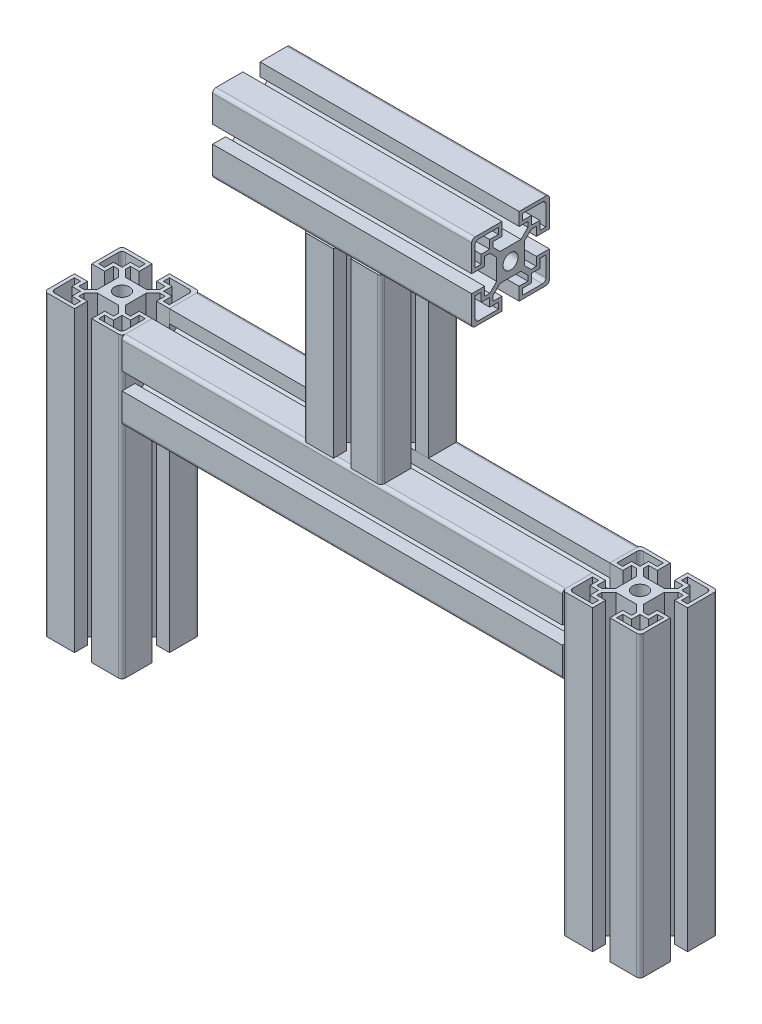
from build123d import *

# Parameters (mm, degrees)
PERFIL_ALUMINIO_45_X_45_1_DEPTH      = 150
PERFIL_ALUMINIO_45_X_45_1_DEPTH_BACK = 22.5
SKETCH16_R                           = 4.356346288
SKETCH16_ON_SEGMENT_2_R              = 4.356346288
PERFIL_ALUMINIO_45_X_45_1_2_DEPTH    = 172.5
SKETCH16_ON_SEGMENT_3_R              = 4.356346288
PERFIL_ALUMINIO_45_X_45_1_3_DEPTH    = 152
SKETCH16_ON_SEGMENT_4_R              = 4.356346288
PERFIL_ALUMINIO_45_X_45_1_4_DEPTH    = 302
SKETCH16_ON_SEGMENT_5_R              = 4.356346288
PERFIL_ALUMINIO_45_X_45_1_5_DEPTH    = 150


with BuildPart() as part:
    # Sketch16 → Perfil aluminio 45 X 45(1) (new, two sides: drawn at the far end of the back side and taken through both)
    with BuildSketch(Plane(origin=(157.534246575, 68.721461187, 0), x_dir=(1, 0, 0), z_dir=(0, -1, 0)).offset(-PERFIL_ALUMINIO_45_X_45_1_DEPTH_BACK)):
        with BuildLine():
            Line((-20.5, 22.5), (-5, 22.5))
            Line((-5, 22.5), (-5, 14.982887044))
            Line((-5, 14.982887044), (-10.05, 14.982887044))
            Line((-10.05, 14.982887044), (-10.05, 11.990221168))
            Line((-10.05, 11.990221168), (-6.059778832, 8))
            Line((-6.059778832, 8), (6.059778832, 8))
            Line((6.059778832, 8), (10.05, 11.990221168))
            Line((10.05, 11.990221168), (10.05, 14.982887044))
            Line((10.05, 14.982887044), (5, 14.982887044))
            Line((5, 14.982887044), (5, 22.5))
            Line((5, 22.5), (20.5, 22.5))
            ThreePointArc((20.5, 22.5), (21.914213562, 21.914213562), (22.5, 20.5))
            Line((22.5, 20.5), (22.5, 5))
            Line((22.5, 5), (14.982887044, 5))
            Line((14.982887044, 5), (14.982887044, 10.05))
            Line((14.982887044, 10.05), (11.990221168, 10.05))
            Line((11.990221168, 10.05), (8, 6.059778832))
            Line((8, 6.059778832), (8, -6.059778832))
            Line((8, -6.059778832), (11.990221168, -10.05))
            Line((11.990221168, -10.05), (14.982887044, -10.05))
            Line((14.982887044, -10.05), (14.982887044, -5))
            Line((14.982887044, -5), (22.5, -5))
            Line((22.5, -5), (22.5, -20.5))
            ThreePointArc((22.5, -20.5), (21.914213562, -21.914213562), (20.5, -22.5))
            Line((20.5, -22.5), (5, -22.5))
            Line((5, -22.5), (5, -14.982887044))
            Line((5, -14.982887044), (10.05, -14.982887044))
            Line((10.05, -14.982887044), (10.05, -11.990221168))
            Line((10.05, -11.990221168), (6.059778832, -8))
            Line((6.059778832, -8), (-6.059778832, -8))
            Line((-6.059778832, -8), (-10.05, -11.990221168))
            Line((-10.05, -11.990221168), (-10.05, -14.982887044))
            Line((-10.05, -14.982887044), (-5, -14.982887044))
            Line((-5, -14.982887044), (-5, -22.5))
            Line((-5, -22.5), (-20.5, -22.5))
            ThreePointArc((-20.5, -22.5), (-21.914213562, -21.914213562), (-22.5, -20.5))
            Line((-22.5, -20.5), (-22.5, -5))
            Line((-22.5, -5), (-14.982887044, -5))
            Line((-14.982887044, -5), (-14.982887044, -10.05))
            Line((-14.982887044, -10.05), (-11.990221168, -10.05))
            Line((-11.990221168, -10.05), (-8, -6.059778832))
            Line((-8, -6.059778832), (-8, 6.059778832))
            Line((-8, 6.059778832), (-11.990221168, 10.05))
            Line((-11.990221168, 10.05), (-14.982887044, 10.05))
            Line((-14.982887044, 10.05), (-14.982887044, 5))
            Line((-14.982887044, 5), (-22.5, 5))
            Line((-22.5, 5), (-22.5, 20.5))
            ThreePointArc((-22.5, 20.5), (-21.914213562, 21.914213562), (-20.5, 22.5))
        make_face()
        Circle(SKETCH16_R, mode=Mode.SUBTRACT)
        with BuildLine():
            Line((12.05, 16.982887044), (12.05, 12.05))
            Line((12.05, 12.05), (16.982887044, 12.05))
            Line((16.982887044, 12.05), (16.982887044, 7))
            Line((16.982887044, 7), (20.5, 7))
            Line((20.5, 7), (20.5, 18.5))
            ThreePointArc((20.5, 18.5), (19.914213562, 19.914213562), (18.5, 20.5))
            Line((18.5, 20.5), (7, 20.5))
            Line((7, 20.5), (7, 16.982887044))
            Line((7, 16.982887044), (12.05, 16.982887044))
        make_face(mode=Mode.SUBTRACT)
        with BuildLine():
            Line((-20.5, 18.5), (-20.5, 7))
            Line((-20.5, 7), (-16.982887044, 7))
            Line((-16.982887044, 7), (-16.982887044, 12.05))
            Line((-16.982887044, 12.05), (-12.05, 12.05))
            Line((-12.05, 12.05), (-12.05, 16.982887044))
            Line((-12.05, 16.982887044), (-7, 16.982887044))
            Line((-7, 16.982887044), (-7, 20.5))
            Line((-7, 20.5), (-18.5, 20.5))
            ThreePointArc((-18.5, 20.5), (-19.914213562, 19.914213562), (-20.5, 18.5))
        make_face(mode=Mode.SUBTRACT)
        with BuildLine():
            Line((12.05, -16.982887044), (12.05, -12.05))
            Line((12.05, -12.05), (16.982887044, -12.05))
            Line((16.982887044, -12.05), (16.982887044, -7))
            Line((16.982887044, -7), (20.5, -7))
            Line((20.5, -7), (20.5, -18.5))
            ThreePointArc((20.5, -18.5), (19.914213562, -19.914213562), (18.5, -20.5))
            Line((18.5, -20.5), (7, -20.5))
            Line((7, -20.5), (7, -16.982887044))
            Line((7, -16.982887044), (12.05, -16.982887044))
        make_face(mode=Mode.SUBTRACT)
        with BuildLine():
            Line((-20.5, -18.5), (-20.5, -7))
            Line((-20.5, -7), (-16.982887044, -7))
            Line((-16.982887044, -7), (-16.982887044, -12.05))
            Line((-16.982887044, -12.05), (-12.05, -12.05))
            Line((-12.05, -12.05), (-12.05, -16.982887044))
            Line((-12.05, -16.982887044), (-7, -16.982887044))
            Line((-7, -16.982887044), (-7, -20.5))
            Line((-7, -20.5), (-18.5, -20.5))
            ThreePointArc((-18.5, -20.5), (-19.914213562, -19.914213562), (-20.5, -18.5))
        make_face(mode=Mode.SUBTRACT)
    extrude(amount=PERFIL_ALUMINIO_45_X_45_1_DEPTH + PERFIL_ALUMINIO_45_X_45_1_DEPTH_BACK)


with BuildPart() as body_2:
    # Sketch16 on segment 2 (carried to segment 2) → Perfil aluminio 45 X 45_1 2 (new body)
    with BuildSketch(Plane(origin=(-142.465753425, 91.221461187, 0), x_dir=(1, 0, 0), z_dir=(0, -1, 0))):
        with BuildLine():
            Line((-20.5, 22.5), (-5, 22.5))
            Line((-5, 22.5), (-5, 14.982887044))
            Line((-5, 14.982887044), (-10.05, 14.982887044))
            Line((-10.05, 14.982887044), (-10.05, 11.990221168))
            Line((-10.05, 11.990221168), (-6.059778832, 8))
            Line((-6.059778832, 8), (6.059778832, 8))
            Line((6.059778832, 8), (10.05, 11.990221168))
            Line((10.05, 11.990221168), (10.05, 14.982887044))
            Line((10.05, 14.982887044), (5, 14.982887044))
            Line((5, 14.982887044), (5, 22.5))
            Line((5, 22.5), (20.5, 22.5))
            ThreePointArc((20.5, 22.5), (21.914213562, 21.914213562), (22.5, 20.5))
            Line((22.5, 20.5), (22.5, 5))
            Line((22.5, 5), (14.982887044, 5))
            Line((14.982887044, 5), (14.982887044, 10.05))
            Line((14.982887044, 10.05), (11.990221168, 10.05))
            Line((11.990221168, 10.05), (8, 6.059778832))
            Line((8, 6.059778832), (8, -6.059778832))
            Line((8, -6.059778832), (11.990221168, -10.05))
            Line((11.990221168, -10.05), (14.982887044, -10.05))
            Line((14.982887044, -10.05), (14.982887044, -5))
            Line((14.982887044, -5), (22.5, -5))
            Line((22.5, -5), (22.5, -20.5))
            ThreePointArc((22.5, -20.5), (21.914213562, -21.914213562), (20.5, -22.5))
            Line((20.5, -22.5), (5, -22.5))
            Line((5, -22.5), (5, -14.982887044))
            Line((5, -14.982887044), (10.05, -14.982887044))
            Line((10.05, -14.982887044), (10.05, -11.990221168))
            Line((10.05, -11.990221168), (6.059778832, -8))
            Line((6.059778832, -8), (-6.059778832, -8))
            Line((-6.059778832, -8), (-10.05, -11.990221168))
            Line((-10.05, -11.990221168), (-10.05, -14.982887044))
            Line((-10.05, -14.982887044), (-5, -14.982887044))
            Line((-5, -14.982887044), (-5, -22.5))
            Line((-5, -22.5), (-20.5, -22.5))
            ThreePointArc((-20.5, -22.5), (-21.914213562, -21.914213562), (-22.5, -20.5))
            Line((-22.5, -20.5), (-22.5, -5))
            Line((-22.5, -5), (-14.982887044, -5))
            Line((-14.982887044, -5), (-14.982887044, -10.05))
            Line((-14.982887044, -10.05), (-11.990221168, -10.05))
            Line((-11.990221168, -10.05), (-8, -6.059778832))
            Line((-8, -6.059778832), (-8, 6.059778832))
            Line((-8, 6.059778832), (-11.990221168, 10.05))
            Line((-11.990221168, 10.05), (-14.982887044, 10.05))
            Line((-14.982887044, 10.05), (-14.982887044, 5))
            Line((-14.982887044, 5), (-22.5, 5))
            Line((-22.5, 5), (-22.5, 20.5))
            ThreePointArc((-22.5, 20.5), (-21.914213562, 21.914213562), (-20.5, 22.5))
        make_face()
        Circle(SKETCH16_ON_SEGMENT_2_R, mode=Mode.SUBTRACT)
        with BuildLine():
            Line((12.05, 16.982887044), (12.05, 12.05))
            Line((12.05, 12.05), (16.982887044, 12.05))
            Line((16.982887044, 12.05), (16.982887044, 7))
            Line((16.982887044, 7), (20.5, 7))
            Line((20.5, 7), (20.5, 18.5))
            ThreePointArc((20.5, 18.5), (19.914213562, 19.914213562), (18.5, 20.5))
            Line((18.5, 20.5), (7, 20.5))
            Line((7, 20.5), (7, 16.982887044))
            Line((7, 16.982887044), (12.05, 16.982887044))
        make_face(mode=Mode.SUBTRACT)
        with BuildLine():
            Line((-20.5, 18.5), (-20.5, 7))
            Line((-20.5, 7), (-16.982887044, 7))
            Line((-16.982887044, 7), (-16.982887044, 12.05))
            Line((-16.982887044, 12.05), (-12.05, 12.05))
            Line((-12.05, 12.05), (-12.05, 16.982887044))
            Line((-12.05, 16.982887044), (-7, 16.982887044))
            Line((-7, 16.982887044), (-7, 20.5))
            Line((-7, 20.5), (-18.5, 20.5))
            ThreePointArc((-18.5, 20.5), (-19.914213562, 19.914213562), (-20.5, 18.5))
        make_face(mode=Mode.SUBTRACT)
        with BuildLine():
            Line((12.05, -16.982887044), (12.05, -12.05))
            Line((12.05, -12.05), (16.982887044, -12.05))
            Line((16.982887044, -12.05), (16.982887044, -7))
            Line((16.982887044, -7), (20.5, -7))
            Line((20.5, -7), (20.5, -18.5))
            ThreePointArc((20.5, -18.5), (19.914213562, -19.914213562), (18.5, -20.5))
            Line((18.5, -20.5), (7, -20.5))
            Line((7, -20.5), (7, -16.982887044))
            Line((7, -16.982887044), (12.05, -16.982887044))
        make_face(mode=Mode.SUBTRACT)
        with BuildLine():
            Line((-20.5, -18.5), (-20.5, -7))
            Line((-20.5, -7), (-16.982887044, -7))
            Line((-16.982887044, -7), (-16.982887044, -12.05))
            Line((-16.982887044, -12.05), (-12.05, -12.05))
            Line((-12.05, -12.05), (-12.05, -16.982887044))
            Line((-12.05, -16.982887044), (-7, -16.982887044))
            Line((-7, -16.982887044), (-7, -20.5))
            Line((-7, -20.5), (-18.5, -20.5))
            ThreePointArc((-18.5, -20.5), (-19.914213562, -19.914213562), (-20.5, -18.5))
        make_face(mode=Mode.SUBTRACT)
    extrude(amount=PERFIL_ALUMINIO_45_X_45_1_2_DEPTH)


with BuildPart() as body_3:
    # Sketch16 on segment 3 (carried to segment 3) → Perfil aluminio 45 X 45_1 3 (new body)
    with BuildSketch(Plane(origin=(7.534246575, 219.721461187, 0), x_dir=(1, 0, 0), z_dir=(0, -1, 0))):
        with BuildLine():
            Line((-20.5, 22.5), (-5, 22.5))
            Line((-5, 22.5), (-5, 14.982887044))
            Line((-5, 14.982887044), (-10.05, 14.982887044))
            Line((-10.05, 14.982887044), (-10.05, 11.990221168))
            Line((-10.05, 11.990221168), (-6.059778832, 8))
            Line((-6.059778832, 8), (6.059778832, 8))
            Line((6.059778832, 8), (10.05, 11.990221168))
            Line((10.05, 11.990221168), (10.05, 14.982887044))
            Line((10.05, 14.982887044), (5, 14.982887044))
            Line((5, 14.982887044), (5, 22.5))
            Line((5, 22.5), (20.5, 22.5))
            ThreePointArc((20.5, 22.5), (21.914213562, 21.914213562), (22.5, 20.5))
            Line((22.5, 20.5), (22.5, 5))
            Line((22.5, 5), (14.982887044, 5))
            Line((14.982887044, 5), (14.982887044, 10.05))
            Line((14.982887044, 10.05), (11.990221168, 10.05))
            Line((11.990221168, 10.05), (8, 6.059778832))
            Line((8, 6.059778832), (8, -6.059778832))
            Line((8, -6.059778832), (11.990221168, -10.05))
            Line((11.990221168, -10.05), (14.982887044, -10.05))
            Line((14.982887044, -10.05), (14.982887044, -5))
            Line((14.982887044, -5), (22.5, -5))
            Line((22.5, -5), (22.5, -20.5))
            ThreePointArc((22.5, -20.5), (21.914213562, -21.914213562), (20.5, -22.5))
            Line((20.5, -22.5), (5, -22.5))
            Line((5, -22.5), (5, -14.982887044))
            Line((5, -14.982887044), (10.05, -14.982887044))
            Line((10.05, -14.982887044), (10.05, -11.990221168))
            Line((10.05, -11.990221168), (6.059778832, -8))
            Line((6.059778832, -8), (-6.059778832, -8))
            Line((-6.059778832, -8), (-10.05, -11.990221168))
            Line((-10.05, -11.990221168), (-10.05, -14.982887044))
            Line((-10.05, -14.982887044), (-5, -14.982887044))
            Line((-5, -14.982887044), (-5, -22.5))
            Line((-5, -22.5), (-20.5, -22.5))
            ThreePointArc((-20.5, -22.5), (-21.914213562, -21.914213562), (-22.5, -20.5))
            Line((-22.5, -20.5), (-22.5, -5))
            Line((-22.5, -5), (-14.982887044, -5))
            Line((-14.982887044, -5), (-14.982887044, -10.05))
            Line((-14.982887044, -10.05), (-11.990221168, -10.05))
            Line((-11.990221168, -10.05), (-8, -6.059778832))
            Line((-8, -6.059778832), (-8, 6.059778832))
            Line((-8, 6.059778832), (-11.990221168, 10.05))
            Line((-11.990221168, 10.05), (-14.982887044, 10.05))
            Line((-14.982887044, 10.05), (-14.982887044, 5))
            Line((-14.982887044, 5), (-22.5, 5))
            Line((-22.5, 5), (-22.5, 20.5))
            ThreePointArc((-22.5, 20.5), (-21.914213562, 21.914213562), (-20.5, 22.5))
        make_face()
        Circle(SKETCH16_ON_SEGMENT_3_R, mode=Mode.SUBTRACT)
        with BuildLine():
            Line((12.05, 16.982887044), (12.05, 12.05))
            Line((12.05, 12.05), (16.982887044, 12.05))
            Line((16.982887044, 12.05), (16.982887044, 7))
            Line((16.982887044, 7), (20.5, 7))
            Line((20.5, 7), (20.5, 18.5))
            ThreePointArc((20.5, 18.5), (19.914213562, 19.914213562), (18.5, 20.5))
            Line((18.5, 20.5), (7, 20.5))
            Line((7, 20.5), (7, 16.982887044))
            Line((7, 16.982887044), (12.05, 16.982887044))
        make_face(mode=Mode.SUBTRACT)
        with BuildLine():
            Line((-20.5, 18.5), (-20.5, 7))
            Line((-20.5, 7), (-16.982887044, 7))
            Line((-16.982887044, 7), (-16.982887044, 12.05))
            Line((-16.982887044, 12.05), (-12.05, 12.05))
            Line((-12.05, 12.05), (-12.05, 16.982887044))
            Line((-12.05, 16.982887044), (-7, 16.982887044))
            Line((-7, 16.982887044), (-7, 20.5))
            Line((-7, 20.5), (-18.5, 20.5))
            ThreePointArc((-18.5, 20.5), (-19.914213562, 19.914213562), (-20.5, 18.5))
        make_face(mode=Mode.SUBTRACT)
        with BuildLine():
            Line((12.05, -16.982887044), (12.05, -12.05))
            Line((12.05, -12.05), (16.982887044, -12.05))
            Line((16.982887044, -12.05), (16.982887044, -7))
            Line((16.982887044, -7), (20.5, -7))
            Line((20.5, -7), (20.5, -18.5))
            ThreePointArc((20.5, -18.5), (19.914213562, -19.914213562), (18.5, -20.5))
            Line((18.5, -20.5), (7, -20.5))
            Line((7, -20.5), (7, -16.982887044))
            Line((7, -16.982887044), (12.05, -16.982887044))
        make_face(mode=Mode.SUBTRACT)
        with BuildLine():
            Line((-20.5, -18.5), (-20.5, -7))
            Line((-20.5, -7), (-16.982887044, -7))
            Line((-16.982887044, -7), (-16.982887044, -12.05))
            Line((-16.982887044, -12.05), (-12.05, -12.05))
            Line((-12.05, -12.05), (-12.05, -16.982887044))
            Line((-12.05, -16.982887044), (-7, -16.982887044))
            Line((-7, -16.982887044), (-7, -20.5))
            Line((-7, -20.5), (-18.5, -20.5))
            ThreePointArc((-18.5, -20.5), (-19.914213562, -19.914213562), (-20.5, -18.5))
        make_face(mode=Mode.SUBTRACT)
    extrude(amount=PERFIL_ALUMINIO_45_X_45_1_3_DEPTH)

    # Perfil aluminio 45 X 45_1 3 end butt 1
    split(bisect_by=Plane(origin=(7.534246575, 91.221461187, 0), x_dir=(-1, 0, 0), z_dir=(0, 1, 0)), keep=Keep.TOP)

    # Perfil aluminio 45 X 45_1 3 end butt 2
    split(bisect_by=Plane(origin=(7.534246575, 196.221461187, 0), x_dir=(1, 0, 0), z_dir=(0, -1, 0)), keep=Keep.TOP)


with BuildPart() as body_4:
    # Sketch16 on segment 4 (carried to segment 4) → Perfil aluminio 45 X 45_1 4 (new body)
    with BuildSketch(Plane(origin=(-143.465753425, 68.721461187, 0), x_dir=(0, 1, 0), z_dir=(1, 0, 0))):
        with BuildLine():
            Line((-20.5, 22.5), (-5, 22.5))
            Line((-5, 22.5), (-5, 14.982887044))
            Line((-5, 14.982887044), (-10.05, 14.982887044))
            Line((-10.05, 14.982887044), (-10.05, 11.990221168))
            Line((-10.05, 11.990221168), (-6.059778832, 8))
            Line((-6.059778832, 8), (6.059778832, 8))
            Line((6.059778832, 8), (10.05, 11.990221168))
            Line((10.05, 11.990221168), (10.05, 14.982887044))
            Line((10.05, 14.982887044), (5, 14.982887044))
            Line((5, 14.982887044), (5, 22.5))
            Line((5, 22.5), (20.5, 22.5))
            ThreePointArc((20.5, 22.5), (21.914213562, 21.914213562), (22.5, 20.5))
            Line((22.5, 20.5), (22.5, 5))
            Line((22.5, 5), (14.982887044, 5))
            Line((14.982887044, 5), (14.982887044, 10.05))
            Line((14.982887044, 10.05), (11.990221168, 10.05))
            Line((11.990221168, 10.05), (8, 6.059778832))
            Line((8, 6.059778832), (8, -6.059778832))
            Line((8, -6.059778832), (11.990221168, -10.05))
            Line((11.990221168, -10.05), (14.982887044, -10.05))
            Line((14.982887044, -10.05), (14.982887044, -5))
            Line((14.982887044, -5), (22.5, -5))
            Line((22.5, -5), (22.5, -20.5))
            ThreePointArc((22.5, -20.5), (21.914213562, -21.914213562), (20.5, -22.5))
            Line((20.5, -22.5), (5, -22.5))
            Line((5, -22.5), (5, -14.982887044))
            Line((5, -14.982887044), (10.05, -14.982887044))
            Line((10.05, -14.982887044), (10.05, -11.990221168))
            Line((10.05, -11.990221168), (6.059778832, -8))
            Line((6.059778832, -8), (-6.059778832, -8))
            Line((-6.059778832, -8), (-10.05, -11.990221168))
            Line((-10.05, -11.990221168), (-10.05, -14.982887044))
            Line((-10.05, -14.982887044), (-5, -14.982887044))
            Line((-5, -14.982887044), (-5, -22.5))
            Line((-5, -22.5), (-20.5, -22.5))
            ThreePointArc((-20.5, -22.5), (-21.914213562, -21.914213562), (-22.5, -20.5))
            Line((-22.5, -20.5), (-22.5, -5))
            Line((-22.5, -5), (-14.982887044, -5))
            Line((-14.982887044, -5), (-14.982887044, -10.05))
            Line((-14.982887044, -10.05), (-11.990221168, -10.05))
            Line((-11.990221168, -10.05), (-8, -6.059778832))
            Line((-8, -6.059778832), (-8, 6.059778832))
            Line((-8, 6.059778832), (-11.990221168, 10.05))
            Line((-11.990221168, 10.05), (-14.982887044, 10.05))
            Line((-14.982887044, 10.05), (-14.982887044, 5))
            Line((-14.982887044, 5), (-22.5, 5))
            Line((-22.5, 5), (-22.5, 20.5))
            ThreePointArc((-22.5, 20.5), (-21.914213562, 21.914213562), (-20.5, 22.5))
        make_face()
        Circle(SKETCH16_ON_SEGMENT_4_R, mode=Mode.SUBTRACT)
        with BuildLine():
            Line((12.05, 16.982887044), (12.05, 12.05))
            Line((12.05, 12.05), (16.982887044, 12.05))
            Line((16.982887044, 12.05), (16.982887044, 7))
            Line((16.982887044, 7), (20.5, 7))
            Line((20.5, 7), (20.5, 18.5))
            ThreePointArc((20.5, 18.5), (19.914213562, 19.914213562), (18.5, 20.5))
            Line((18.5, 20.5), (7, 20.5))
            Line((7, 20.5), (7, 16.982887044))
            Line((7, 16.982887044), (12.05, 16.982887044))
        make_face(mode=Mode.SUBTRACT)
        with BuildLine():
            Line((-20.5, 18.5), (-20.5, 7))
            Line((-20.5, 7), (-16.982887044, 7))
            Line((-16.982887044, 7), (-16.982887044, 12.05))
            Line((-16.982887044, 12.05), (-12.05, 12.05))
            Line((-12.05, 12.05), (-12.05, 16.982887044))
            Line((-12.05, 16.982887044), (-7, 16.982887044))
            Line((-7, 16.982887044), (-7, 20.5))
            Line((-7, 20.5), (-18.5, 20.5))
            ThreePointArc((-18.5, 20.5), (-19.914213562, 19.914213562), (-20.5, 18.5))
        make_face(mode=Mode.SUBTRACT)
        with BuildLine():
            Line((12.05, -16.982887044), (12.05, -12.05))
            Line((12.05, -12.05), (16.982887044, -12.05))
            Line((16.982887044, -12.05), (16.982887044, -7))
            Line((16.982887044, -7), (20.5, -7))
            Line((20.5, -7), (20.5, -18.5))
            ThreePointArc((20.5, -18.5), (19.914213562, -19.914213562), (18.5, -20.5))
            Line((18.5, -20.5), (7, -20.5))
            Line((7, -20.5), (7, -16.982887044))
            Line((7, -16.982887044), (12.05, -16.982887044))
        make_face(mode=Mode.SUBTRACT)
        with BuildLine():
            Line((-20.5, -18.5), (-20.5, -7))
            Line((-20.5, -7), (-16.982887044, -7))
            Line((-16.982887044, -7), (-16.982887044, -12.05))
            Line((-16.982887044, -12.05), (-12.05, -12.05))
            Line((-12.05, -12.05), (-12.05, -16.982887044))
            Line((-12.05, -16.982887044), (-7, -16.982887044))
            Line((-7, -16.982887044), (-7, -20.5))
            Line((-7, -20.5), (-18.5, -20.5))
            ThreePointArc((-18.5, -20.5), (-19.914213562, -19.914213562), (-20.5, -18.5))
        make_face(mode=Mode.SUBTRACT)
    extrude(amount=PERFIL_ALUMINIO_45_X_45_1_4_DEPTH)

    # Perfil aluminio 45 X 45_1 4 end butt 1
    split(bisect_by=Plane(origin=(-119.965753425, 68.721461187, 0), x_dir=(0, 1, 0), z_dir=(1, 0, 0)), keep=Keep.TOP)

    # Perfil aluminio 45 X 45_1 4 end butt 2
    split(bisect_by=Plane(origin=(135.034246575, 68.721461187, 0), x_dir=(0, -1, 0), z_dir=(-1, 0, 0)), keep=Keep.TOP)


with BuildPart() as body_5:
    # Sketch16 on segment 5 (carried to segment 5) → Perfil aluminio 45 X 45_1 5 (new body)
    with BuildSketch(Plane(origin=(-67.465753425, 218.721461187, 0), x_dir=(0, 1, 0), z_dir=(1, 0, 0))):
        with BuildLine():
            Line((-20.5, 22.5), (-5, 22.5))
            Line((-5, 22.5), (-5, 14.982887044))
            Line((-5, 14.982887044), (-10.05, 14.982887044))
            Line((-10.05, 14.982887044), (-10.05, 11.990221168))
            Line((-10.05, 11.990221168), (-6.059778832, 8))
            Line((-6.059778832, 8), (6.059778832, 8))
            Line((6.059778832, 8), (10.05, 11.990221168))
            Line((10.05, 11.990221168), (10.05, 14.982887044))
            Line((10.05, 14.982887044), (5, 14.982887044))
            Line((5, 14.982887044), (5, 22.5))
            Line((5, 22.5), (20.5, 22.5))
            ThreePointArc((20.5, 22.5), (21.914213562, 21.914213562), (22.5, 20.5))
            Line((22.5, 20.5), (22.5, 5))
            Line((22.5, 5), (14.982887044, 5))
            Line((14.982887044, 5), (14.982887044, 10.05))
            Line((14.982887044, 10.05), (11.990221168, 10.05))
            Line((11.990221168, 10.05), (8, 6.059778832))
            Line((8, 6.059778832), (8, -6.059778832))
            Line((8, -6.059778832), (11.990221168, -10.05))
            Line((11.990221168, -10.05), (14.982887044, -10.05))
            Line((14.982887044, -10.05), (14.982887044, -5))
            Line((14.982887044, -5), (22.5, -5))
            Line((22.5, -5), (22.5, -20.5))
            ThreePointArc((22.5, -20.5), (21.914213562, -21.914213562), (20.5, -22.5))
            Line((20.5, -22.5), (5, -22.5))
            Line((5, -22.5), (5, -14.982887044))
            Line((5, -14.982887044), (10.05, -14.982887044))
            Line((10.05, -14.982887044), (10.05, -11.990221168))
            Line((10.05, -11.990221168), (6.059778832, -8))
            Line((6.059778832, -8), (-6.059778832, -8))
            Line((-6.059778832, -8), (-10.05, -11.990221168))
            Line((-10.05, -11.990221168), (-10.05, -14.982887044))
            Line((-10.05, -14.982887044), (-5, -14.982887044))
            Line((-5, -14.982887044), (-5, -22.5))
            Line((-5, -22.5), (-20.5, -22.5))
            ThreePointArc((-20.5, -22.5), (-21.914213562, -21.914213562), (-22.5, -20.5))
            Line((-22.5, -20.5), (-22.5, -5))
            Line((-22.5, -5), (-14.982887044, -5))
            Line((-14.982887044, -5), (-14.982887044, -10.05))
            Line((-14.982887044, -10.05), (-11.990221168, -10.05))
            Line((-11.990221168, -10.05), (-8, -6.059778832))
            Line((-8, -6.059778832), (-8, 6.059778832))
            Line((-8, 6.059778832), (-11.990221168, 10.05))
            Line((-11.990221168, 10.05), (-14.982887044, 10.05))
            Line((-14.982887044, 10.05), (-14.982887044, 5))
            Line((-14.982887044, 5), (-22.5, 5))
            Line((-22.5, 5), (-22.5, 20.5))
            ThreePointArc((-22.5, 20.5), (-21.914213562, 21.914213562), (-20.5, 22.5))
        make_face()
        Circle(SKETCH16_ON_SEGMENT_5_R, mode=Mode.SUBTRACT)
        with BuildLine():
            Line((12.05, 16.982887044), (12.05, 12.05))
            Line((12.05, 12.05), (16.982887044, 12.05))
            Line((16.982887044, 12.05), (16.982887044, 7))
            Line((16.982887044, 7), (20.5, 7))
            Line((20.5, 7), (20.5, 18.5))
            ThreePointArc((20.5, 18.5), (19.914213562, 19.914213562), (18.5, 20.5))
            Line((18.5, 20.5), (7, 20.5))
            Line((7, 20.5), (7, 16.982887044))
            Line((7, 16.982887044), (12.05, 16.982887044))
        make_face(mode=Mode.SUBTRACT)
        with BuildLine():
            Line((-20.5, 18.5), (-20.5, 7))
            Line((-20.5, 7), (-16.982887044, 7))
            Line((-16.982887044, 7), (-16.982887044, 12.05))
            Line((-16.982887044, 12.05), (-12.05, 12.05))
            Line((-12.05, 12.05), (-12.05, 16.982887044))
            Line((-12.05, 16.982887044), (-7, 16.982887044))
            Line((-7, 16.982887044), (-7, 20.5))
            Line((-7, 20.5), (-18.5, 20.5))
            ThreePointArc((-18.5, 20.5), (-19.914213562, 19.914213562), (-20.5, 18.5))
        make_face(mode=Mode.SUBTRACT)
        with BuildLine():
            Line((12.05, -16.982887044), (12.05, -12.05))
            Line((12.05, -12.05), (16.982887044, -12.05))
            Line((16.982887044, -12.05), (16.982887044, -7))
            Line((16.982887044, -7), (20.5, -7))
            Line((20.5, -7), (20.5, -18.5))
            ThreePointArc((20.5, -18.5), (19.914213562, -19.914213562), (18.5, -20.5))
            Line((18.5, -20.5), (7, -20.5))
            Line((7, -20.5), (7, -16.982887044))
            Line((7, -16.982887044), (12.05, -16.982887044))
        make_face(mode=Mode.SUBTRACT)
        with BuildLine():
            Line((-20.5, -18.5), (-20.5, -7))
            Line((-20.5, -7), (-16.982887044, -7))
            Line((-16.982887044, -7), (-16.982887044, -12.05))
            Line((-16.982887044, -12.05), (-12.05, -12.05))
            Line((-12.05, -12.05), (-12.05, -16.982887044))
            Line((-12.05, -16.982887044), (-7, -16.982887044))
            Line((-7, -16.982887044), (-7, -20.5))
            Line((-7, -20.5), (-18.5, -20.5))
            ThreePointArc((-18.5, -20.5), (-19.914213562, -19.914213562), (-20.5, -18.5))
        make_face(mode=Mode.SUBTRACT)
    extrude(amount=PERFIL_ALUMINIO_45_X_45_1_5_DEPTH)


solid = Compound([part.part, body_2.part, body_3.part, body_4.part, body_5.part])
